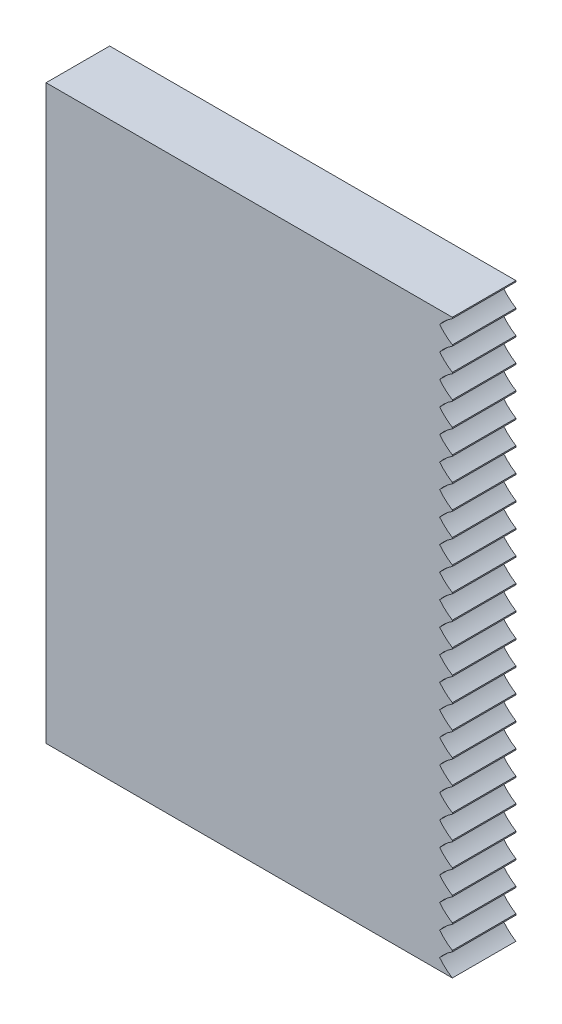
from build123d import *

# Parameters (mm, degrees)
SKETCH_1_W             = 31.95
SKETCH_1_H             = 45
EXTRUDE_1_DEPTH        = 5
CUT_EXTRUDE_1_DEPTH    = 56.414822024
PATTERN_LINEAR_1_COUNT = 24
PATTERN_LINEAR_1_PITCH = 1.875


with BuildPart() as part:
    # 스케치1 → 보스-돌출1 (new body)
    with BuildSketch(Plane.XY):
        with Locations((15.975, 22.5)):
            Rectangle(SKETCH_1_W, SKETCH_1_H)
    extrude(amount=EXTRUDE_1_DEPTH)

    # 스케치2 → 컷-돌출1 (cut, through all)
    with BuildSketch(Plane.XY.offset(5)):
        with BuildLine():
            Line((34.075880325, 2.389576785), (34.075880325, -0.610423215))
            ThreePointArc((34.075880325, -0.610423215), (32.34230542, -0.216012405), (30.95, 0.889576785))
            ThreePointArc((30.95, 0.889576785), (32.34230542, 1.995165974), (34.075880325, 2.389576785))
        make_face()
    cut_extrude_1 = extrude(amount=-CUT_EXTRUDE_1_DEPTH, mode=Mode.SUBTRACT)

    # 선형 패턴1: 컷-돌출1 ×24
    with Locations(*[(0, i * PATTERN_LINEAR_1_PITCH, 0) for i in range(1, PATTERN_LINEAR_1_COUNT)]):
        add(cut_extrude_1, mode=Mode.SUBTRACT)


solid = part.part
